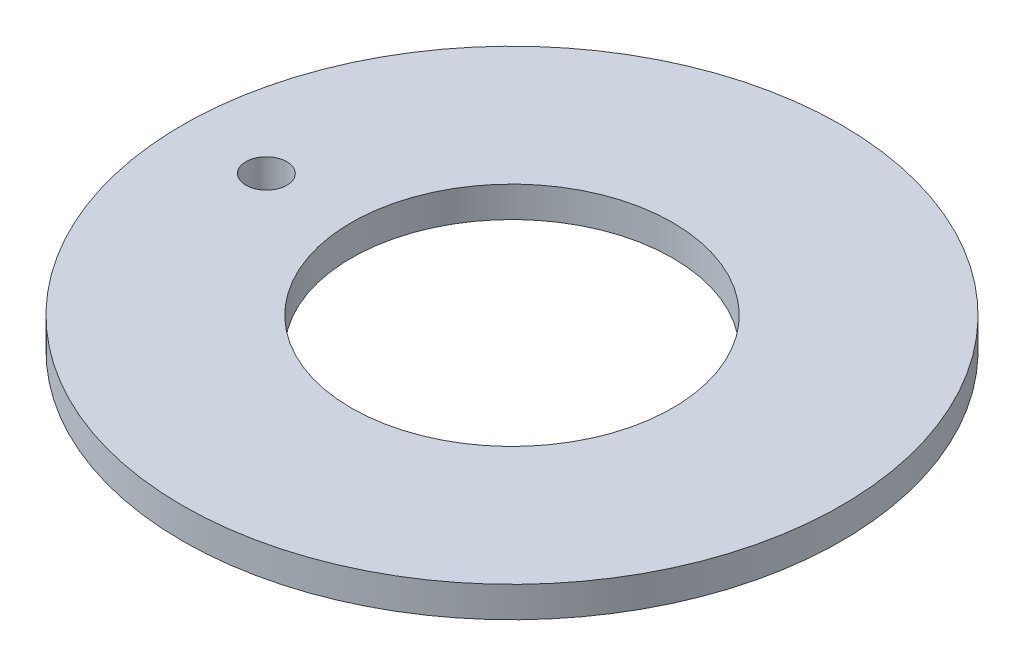
from build123d import *

# Parameters (mm, degrees)
SKETCH1_R           = 32.2
SKETCH1_R_2         = 15.7
BOSS_EXTRUDE1_DEPTH = 3
SKETCH2_R           = 2
CUT_EXTRUDE1_DEPTH  = 46.636388989


with BuildPart() as part:
    # Sketch1 → Boss-Extrude1 (new body)
    with BuildSketch(Plane(origin=(0, 0, 0), x_dir=(1, 0, 0), z_dir=(0, 1, 0))):
        with Locations(Location((0, 0, 0), (0, 0, 270))):
            Circle(SKETCH1_R)
        with Locations(Location((0, 0, 0), (0, 0, 270))):
            Circle(SKETCH1_R_2, mode=Mode.SUBTRACT)
    extrude(amount=BOSS_EXTRUDE1_DEPTH)

    # Sketch2 → Cut-Extrude1 (cut, through all)
    with BuildSketch(Plane(origin=(0, 3, 0), x_dir=(1, 0, 0), z_dir=(0, 1, 0))):
        with Locations(Location((-24, 0, 0), (0, 0, 270))):
            Circle(SKETCH2_R)
    extrude(amount=-CUT_EXTRUDE1_DEPTH, mode=Mode.SUBTRACT)


solid = part.part
